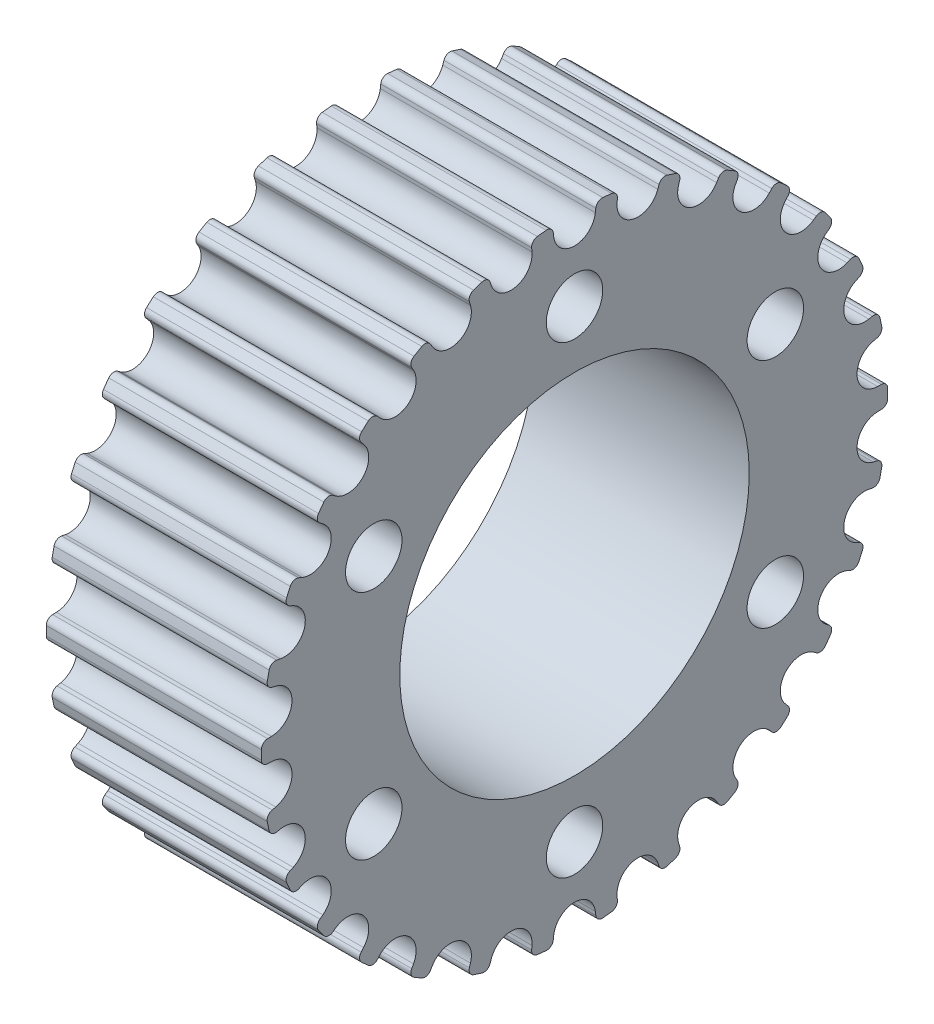
from build123d import *

# Parameters (mm, degrees)
CUT_EXTRUDE_2_REACH      = 40.549
PATTERN_CIRCULAR_3_COUNT = 30
SKETCH_7_R               = 13
SKETCH_7_R_2             = 2.1
CUT_EXTRUDE_3_DEPTH      = 59


with BuildPart() as part:
    # 草图1 → 旋转1 (revolve)
    with BuildSketch(Plane.XY):
        Polygon((0, 2.7506), (0, 23.303), (16, 23.303), (16, 5.5012), (20, 5.5012), (20, 2.7506), align=None)
    revolve(axis=Axis((0, 0, 0), (1, 0, 0)))

    # 草图6 → 切除-拉伸2 (cut, up to next)
    with BuildSketch(Plane(origin=(0, 0, 0), x_dir=(0, 0, -1), z_dir=(1, 0, 0)), mode=Mode.PRIVATE) as cut_extrude_2_sk1:
        with BuildLine():
            Line((1.582208934, 22.788463564), (1.548371997, 22.512883824))
            ThreePointArc((1.548371997, 22.512883824), (0, 21.143), (-1.548371997, 22.512883824))
            Line((-1.548371997, 22.512883824), (-1.582208934, 22.788463564))
            ThreePointArc((-1.582208934, 22.788463564), (-1.757127668, 23.103457495), (-2.101927013, 23.208009648))
            ThreePointArc((-2.101927013, 23.208009648), (-2.340837217, 23.185130798), (-2.579499119, 23.1597926))
            Line((-2.579499119, 23.1597926), (-2.776147107, 24.761361943))
            ThreePointArc((-2.776147107, 24.761361943), (0, 24.91650132), (2.776147107, 24.761361943))
            Line((2.776147107, 24.761361943), (2.579499119, 23.1597926))
            ThreePointArc((2.579499119, 23.1597926), (2.340837217, 23.185130798), (2.101927013, 23.208009648))
            ThreePointArc((2.101927013, 23.208009648), (1.757127668, 23.103457495), (1.582208934, 22.788463564))
        make_face()
    cut_extrude_2_tool1 = extrude(cut_extrude_2_sk1.sketch, amount=CUT_EXTRUDE_2_REACH, mode=Mode.PRIVATE) & part.part
    cut_extrude_2 = cut_extrude_2_tool1.solids().sort_by_distance((0, 23.387918, 0))[0]
    add(cut_extrude_2, mode=Mode.SUBTRACT)

    # 阵列(圆周)3: 切除-拉伸2 ×30 about axis
    pattern_circular_3_axis = Axis((-1, 0, 0), (1, 0, 0))
    for i in range(1, PATTERN_CIRCULAR_3_COUNT):
        add(cut_extrude_2.rotate(pattern_circular_3_axis, i * 360 / PATTERN_CIRCULAR_3_COUNT), mode=Mode.SUBTRACT)

    # 草图7 → 切除-拉伸3 (cut, symmetric)
    with BuildSketch(Plane(origin=(16, 0, 0), x_dir=(0, 0, -1), z_dir=(1, 0, 0))):
        Circle(SKETCH_7_R)
        with Locations((0, 17.25)):
            Circle(SKETCH_7_R_2)
        with Locations((14.938938215, 8.625)):
            Circle(SKETCH_7_R_2)
        with Locations((14.938938215, -8.625)):
            Circle(SKETCH_7_R_2)
        with Locations((0, -17.25)):
            Circle(SKETCH_7_R_2)
        with Locations((-14.938938215, -8.625)):
            Circle(SKETCH_7_R_2)
        with Locations((-14.938938215, 8.625)):
            Circle(SKETCH_7_R_2)
    extrude(amount=CUT_EXTRUDE_3_DEPTH, both=True, mode=Mode.SUBTRACT)


solid = part.part
